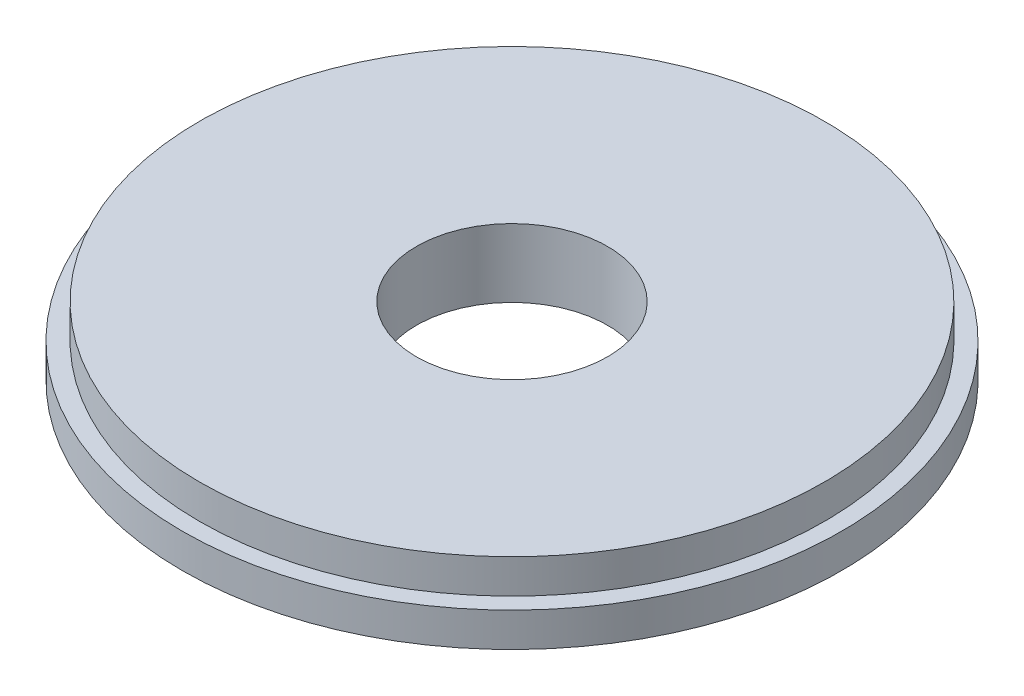
from build123d import *

# Parameters (mm, degrees)
SKETCH1_R           = 48.25
BOSS_EXTRUDE1_DEPTH = 5
SKETCH2_R           = 45.75
BOSS_EXTRUDE2_DEPTH = 5
SKETCH3_R           = 14
CUT_EXTRUDE1_DEPTH  = 69.964664865


with BuildPart() as part:
    # Sketch1 → Boss-Extrude1 (new body)
    with BuildSketch(Plane(origin=(0, 0, 0), x_dir=(1, 0, 0), z_dir=(0, 1, 0))):
        with Locations(Location((0, 0, 0), (0, 0, 270))):
            Circle(SKETCH1_R)
    extrude(amount=BOSS_EXTRUDE1_DEPTH)

    # Sketch2 → Boss-Extrude2 (add)
    with BuildSketch(Plane(origin=(0, 5, 0), x_dir=(1, 0, 0), z_dir=(0, 1, 0))):
        with Locations(Location((0, 0, 0), (0, 0, 270))):
            Circle(SKETCH2_R)
    extrude(amount=BOSS_EXTRUDE2_DEPTH)

    # Sketch3 → Cut-Extrude1 (cut, through all)
    with BuildSketch(Plane(origin=(0, 10, 0), x_dir=(1, 0, 0), z_dir=(0, 1, 0))):
        with Locations(Location((0, 0, 0), (0, 0, 270))):
            Circle(SKETCH3_R)
    extrude(amount=-CUT_EXTRUDE1_DEPTH, mode=Mode.SUBTRACT)


solid = part.part
